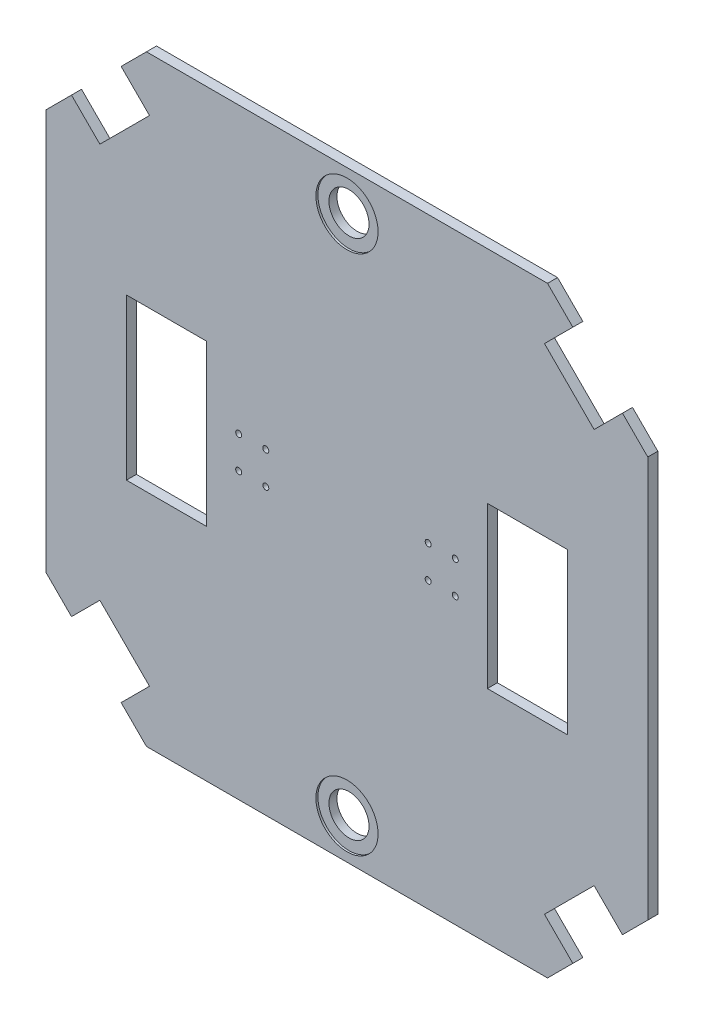
from build123d import *

# Parameters (mm, degrees)
ESQUISSE1_W             = 40
ESQUISSE1_H             = 80
ESQUISSE1_R             = 10
BOSS_EXTRU_1_DEPTH      = 5
ESQUISSE2_R             = 15.5
ENL_V_MAT_EXTRU_1_DEPTH = 1
ESQUISSE3_R             = 1.5
ENL_V_MAT_EXTRU_2_DEPTH = 213.190951739


with BuildPart() as part:
    # Esquisse1 → Boss.-Extru.1 (new body)
    with BuildSketch(Plane.XY):
        Polygon((112.625631329, 137.374368671), (100, 150), (-100, 150), (-112.625631329, 137.374368671), (-98.483495706, 123.232233047), (-123.232233047, 98.483495706), (-137.374368671, 112.625631329), (-150, 100), (-150, -100), (-137.374368671, -112.625631329), (-123.232233047, -98.483495706), (-98.483495706, -123.232233047), (-112.625631329, -137.374368671), (-100, -150), (100, -150), (112.625631329, -137.374368671), (98.483495706, -123.232233047), (123.232233047, -98.483495706), (137.374368671, -112.625631329), (150, -100), (150, 100), (137.374368671, 112.625631329), (123.232233047, 98.483495706), (98.483495706, 123.232233047), align=None)
        with Locations((-90, 0)):
            Rectangle(ESQUISSE1_W, ESQUISSE1_H, mode=Mode.SUBTRACT)
        with Locations((0, -130)):
            Circle(ESQUISSE1_R, mode=Mode.SUBTRACT)
        with Locations((90, 0)):
            Rectangle(ESQUISSE1_W, ESQUISSE1_H, mode=Mode.SUBTRACT)
        with Locations((0, 130)):
            Circle(ESQUISSE1_R, mode=Mode.SUBTRACT)
    extrude(amount=BOSS_EXTRU_1_DEPTH)

    # Esquisse2 → Enlèv. mat.-Extru.1 (cut)
    with BuildSketch(Plane.XY.offset(5)):
        with Locations((0, 130)):
            Circle(ESQUISSE2_R)
        with Locations(Location((0, -130, 0), (0, 0, 180))):
            Circle(ESQUISSE2_R)
    extrude(amount=-ENL_V_MAT_EXTRU_1_DEPTH, mode=Mode.SUBTRACT)

    # Esquisse3 → Enlèv. mat.-Extru.2 (cut, through all)
    with BuildSketch(Plane(origin=(0, 0, 0), x_dir=(-1, 0, 0), z_dir=(0, 0, -1))):
        with Locations((-40.5, 8.042853971)):
            Circle(ESQUISSE3_R)
        with Locations((-40.5, -8.042853971)):
            Circle(ESQUISSE3_R)
        with Locations((-54, 8.042853971)):
            Circle(ESQUISSE3_R)
        with Locations((-54, -8.042853971)):
            Circle(ESQUISSE3_R)
        with Locations((40.5, -8.042853971)):
            Circle(ESQUISSE3_R)
        with Locations((54, -8.042853971)):
            Circle(ESQUISSE3_R)
        with Locations((54, 8.042853971)):
            Circle(ESQUISSE3_R)
        with Locations((40.5, 8.042853971)):
            Circle(ESQUISSE3_R)
    extrude(amount=-ENL_V_MAT_EXTRU_2_DEPTH, mode=Mode.SUBTRACT)


solid = part.part
